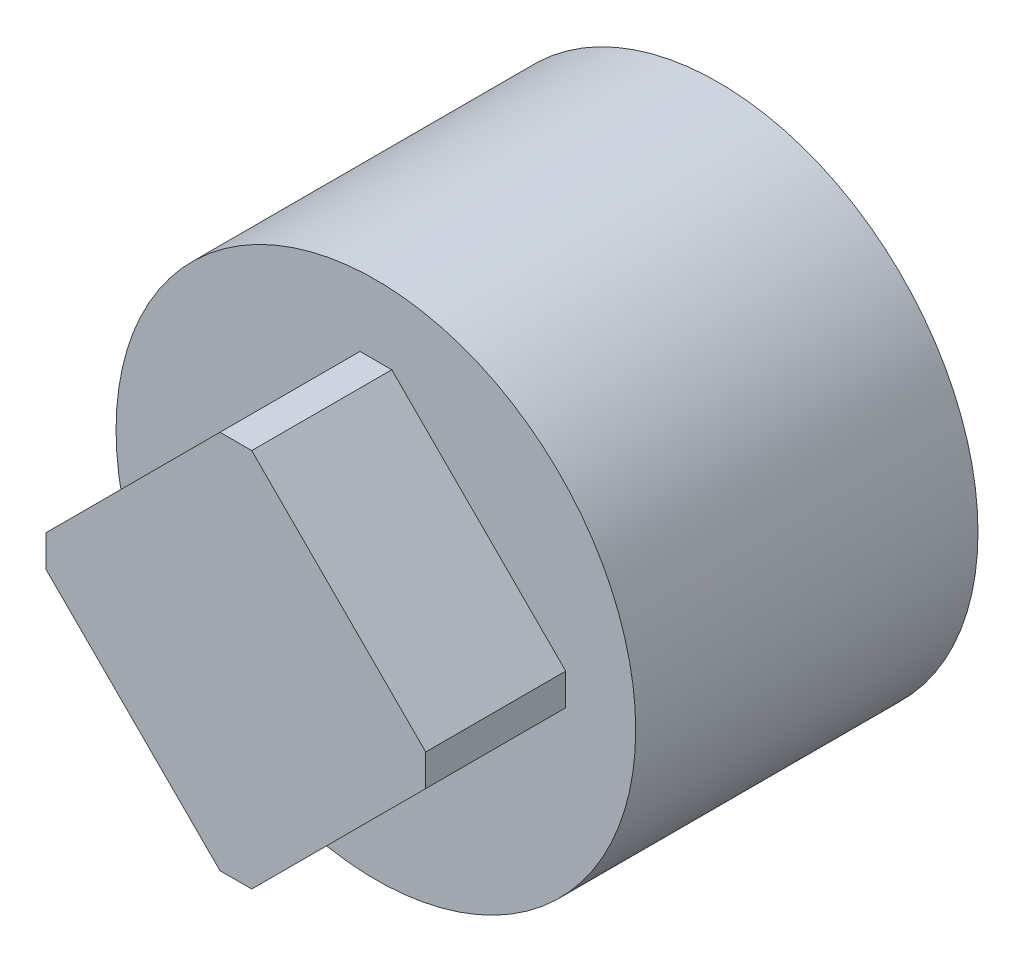
from build123d import *

# Parameters (mm, degrees)
REPLACEABLE_START                           = 1
SKETCH1_R                                   = 16.7
REPLACEABLE_DRIVE_INSERT_BODY_DEPTH         = 22
COMMON_START                                = 23
COMMON_POSITIVE_DRIVE_TANG_DEPTH            = 9
VALVE_START                                 = 1
VALVE_STEM_SOCKET_NOMINAL_FLATS_14_MM_DEPTH = 19.1
STEM_START                                  = 1
SKETCH4_R                                   = 10.2
STEM_CORNER_CLEARANCE_AT_ENTRY_DEPTH        = 1.1


with BuildPart() as part:
    # Sketch1 → Replaceable drive insert body (new body)
    with BuildSketch(Plane.XY.offset(REPLACEABLE_START)):
        Circle(SKETCH1_R)
    extrude(amount=REPLACEABLE_DRIVE_INSERT_BODY_DEPTH)

    # Sketch2 → Common positive drive tang (add)
    with BuildSketch(Plane.XY.offset(COMMON_START)):
        Polygon((1.02, 12.202896808), (-1.02, 12.202896808), (-12.202896808, 1.02), (-12.202896808, -1.02), (-1.02, -12.202896808), (1.02, -12.202896808), (12.202896808, -1.02), (12.202896808, 1.02), align=None)
    extrude(amount=COMMON_POSITIVE_DRIVE_TANG_DEPTH)

    # Sketch3 → Valve stem socket, nominal flats 14 mm (cut)
    with BuildSketch(Plane.XY.offset(VALVE_START)):
        Polygon((1.02, 9.020916293), (-1.02, 9.020916293), (-9.020916293, 1.02), (-9.020916293, -1.02), (-1.02, -9.020916293), (1.02, -9.020916293), (9.020916293, -1.02), (9.020916293, 1.02), align=None)
    extrude(amount=VALVE_STEM_SOCKET_NOMINAL_FLATS_14_MM_DEPTH, mode=Mode.SUBTRACT)

    # Sketch4 → Stem corner clearance at entry (cut)
    with BuildSketch(Plane.XY.offset(STEM_START)):
        Circle(SKETCH4_R)
    extrude(amount=STEM_CORNER_CLEARANCE_AT_ENTRY_DEPTH, mode=Mode.SUBTRACT)


solid = part.part
